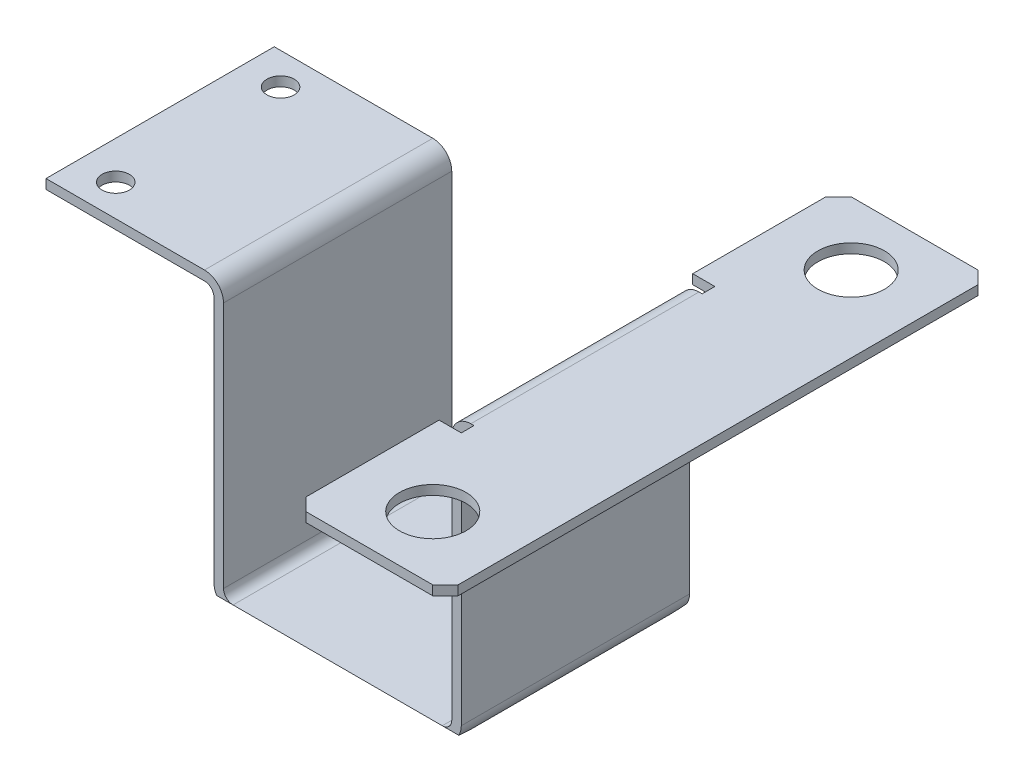
from build123d import *

# Parameters (mm, degrees)
EXTRUDE_1_DEPTH     = 36
SKETCH_2_R          = 2.15
CUT_EXTRUDE_1_DEPTH = 35
FILLET_1_R          = 1.5
FILLET_2_R          = 3
CUT_EXTRUDE_5_DEPTH = 50
SKETCH_5_W          = 24
SKETCH_5_H          = 86
SKETCH_5_R          = 5.25
EXTRUDE_2_DEPTH     = 1.5
SKETCH_6_W          = 2
SKETCH_6_H          = 6.336440046
CUT_EXTRUDE_6_DEPTH = 3.5
FILLET_3_R          = 1.5
FILLET_4_R          = 3
CHAMFER_1_SIZE      = 2
SKETCH_7_W          = 36
SKETCH_7_H          = 1.5
CUT_EXTRUDE_7_DEPTH = 4


with BuildPart() as part:
    # Эскиз1 → Вытянуть1 (new body)
    with BuildSketch(Plane.XY):
        Polygon((-32, 43.5), (0, 43.5), (0, 0), (36, 0), (36, 43.5), (60, 43.5), (60, 42), (37.5, 42), (37.5, -1.5), (-1.5, -1.5), (-1.5, 42), (-32, 42), align=None)
    extrude(amount=EXTRUDE_1_DEPTH)

    # Эскиз2 → Вырез-Вытянуть1 (cut)
    with BuildSketch(Plane(origin=(0, 43.5, 0), x_dir=(-1, 0, 0), z_dir=(0, 1, 0))):
        with Locations(Location((22, 5, 0), (0, 0, 90))):
            Circle(SKETCH_2_R)
        with Locations(Location((22, 31, 0), (0, 0, 90))):
            Circle(SKETCH_2_R)
    extrude(amount=-CUT_EXTRUDE_1_DEPTH, mode=Mode.SUBTRACT)

    # Скругление1
    fillet_1_edges = [part.edges().sort_by_distance(p)[0] for p in [
        (0, 0, 18),
        (36, 0, 18),
        (-1.5, 42, 18),
    ]]
    fillet(fillet_1_edges, radius=FILLET_1_R)

    # Скругление2
    fillet_2_edges = [part.edges().sort_by_distance(p)[0] for p in [
        (0, 43.5, 18),
        (37.5, -1.5, 18),
        (-1.5, -1.5, 18),
    ]]
    fillet(fillet_2_edges, radius=FILLET_2_R)

    # Эскиз4 → Вырез-Вытянуть5 (cut)
    with BuildSketch(Plane.ZY.offset(1.5)):
        Polygon((36, 0), (30.401923789, -1.5), (5.598076211, -1.5), (0, 0), (0, -9.726752533), (36, -8.93099636), align=None)
    extrude(amount=-CUT_EXTRUDE_5_DEPTH, mode=Mode.SUBTRACT)

    # Эскиз5 → Вытянуть2 (add)
    with BuildSketch(Plane(origin=(0, 43.5, 0), x_dir=(-1, 0, 0), z_dir=(0, 1, 0))):
        with Locations((-48, 18)):
            Rectangle(SKETCH_5_W, SKETCH_5_H)
        with Locations(Location((-48, -15, 0), (0, 0, 90))):
            Circle(SKETCH_5_R, mode=Mode.SUBTRACT)
        with Locations(Location((-48, 51, 0), (0, 0, 270))):
            Circle(SKETCH_5_R, mode=Mode.SUBTRACT)
    extrude(amount=-EXTRUDE_2_DEPTH)

    # Эскиз6 → Вырез-Вытянуть6 (cut)
    with BuildSketch(Plane.ZY.offset(-36)):
        with Locations((37, 42.938728947)):
            Rectangle(SKETCH_6_W, SKETCH_6_H)
        with Locations((-1, 42.938728947)):
            Rectangle(SKETCH_6_W, SKETCH_6_H)
    extrude(amount=-CUT_EXTRUDE_6_DEPTH, mode=Mode.SUBTRACT)

    # Скругление3
    fillet_3_edges = [part.edges().sort_by_distance(p)[0] for p in [
        (37.5, 42, 18),
    ]]
    fillet(fillet_3_edges, radius=FILLET_3_R)

    # Скругление4
    fillet_4_edges = [part.edges().sort_by_distance(p)[0] for p in [
        (36, 43.5, 18),
    ]]
    fillet(fillet_4_edges, radius=FILLET_4_R)

    # Фаска1
    chamfer_1_edges = [part.edges().sort_by_distance(p)[0] for p in [
        (36, 42.75, 61),
        (36, 42.75, -25),
        (60, 42.75, -25),
        (60, 42.75, 61),
    ]]
    chamfer(chamfer_1_edges, length=CHAMFER_1_SIZE)

    # Эскиз7 → Вырез-Вытянуть7 (cut)
    with BuildSketch(Plane.ZY.offset(32)):
        with Locations((18, 42.75)):
            Rectangle(SKETCH_7_W, SKETCH_7_H)
    extrude(amount=-CUT_EXTRUDE_7_DEPTH, mode=Mode.SUBTRACT)


solid = part.part
